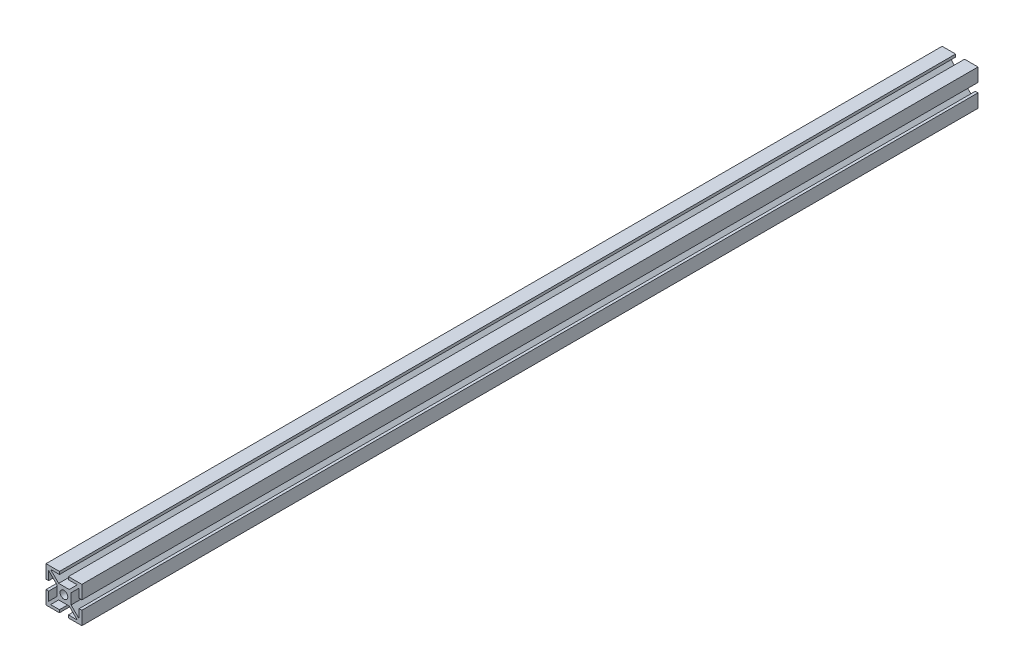
from build123d import *

# Parameters (mm, degrees)
SKIZZE2_R                       = 2.15
AUFSATZ_LINEAR_AUSTRAGEN1_DEPTH = 500


with BuildPart() as part:
    # Skizze2 → Aufsatz-Linear austragen1 (new body)
    with BuildSketch(Plane.XY):
        Polygon((-10, -2.5), (-10, -10), (-2.5, -10), (-2.5, -8.5), (-7.439339828, -8.5), (-2.939339828, -4), (2.939339828, -4), (7.439339828, -8.5), (2.5, -8.5), (2.5, -10), (10, -10), (10, -2.5), (8.495523259, -2.5), (8.495523259, -7.434863087), (4, -2.939339828), (4, 2.939339828), (8.495523259, 7.434863087), (8.495523259, 2.5), (10, 2.5), (10, 10), (2.5, 10), (2.5, 8.5), (7.439339828, 8.5), (2.939339828, 4), (-2.939339828, 4), (-7.439339828, 8.5), (-2.5, 8.5), (-2.5, 10), (-10, 10), (-10, 2.5), (-8.5, 2.5), (-8.5, 7.439339828), (-4, 2.939339828), (-4, -2.939339828), (-8.5, -7.439339828), (-8.5, -2.5), align=None)
        Circle(SKIZZE2_R, mode=Mode.SUBTRACT)
    extrude(amount=AUFSATZ_LINEAR_AUSTRAGEN1_DEPTH)


solid = part.part
